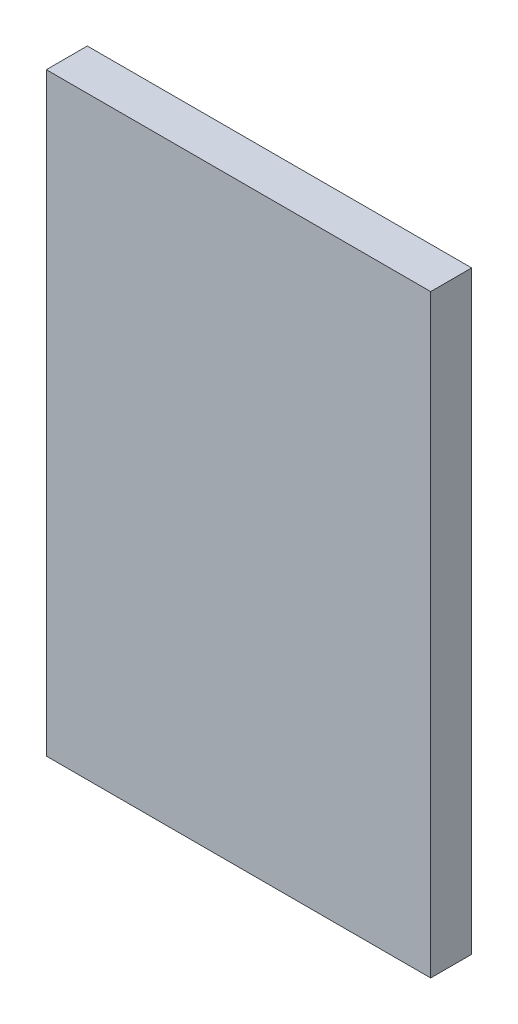
from build123d import *

# Parameters (mm, degrees)
SKETCH_1_W      = 37.5
SKETCH_1_H      = 58
EXTRUDE_1_DEPTH = 4


with BuildPart() as part:
    # 草图1 → 凸台-拉伸1 (new body)
    with BuildSketch(Plane.XY):
        with Locations((-18.75, 29)):
            Rectangle(SKETCH_1_W, SKETCH_1_H)
    extrude(amount=EXTRUDE_1_DEPTH)


solid = part.part
